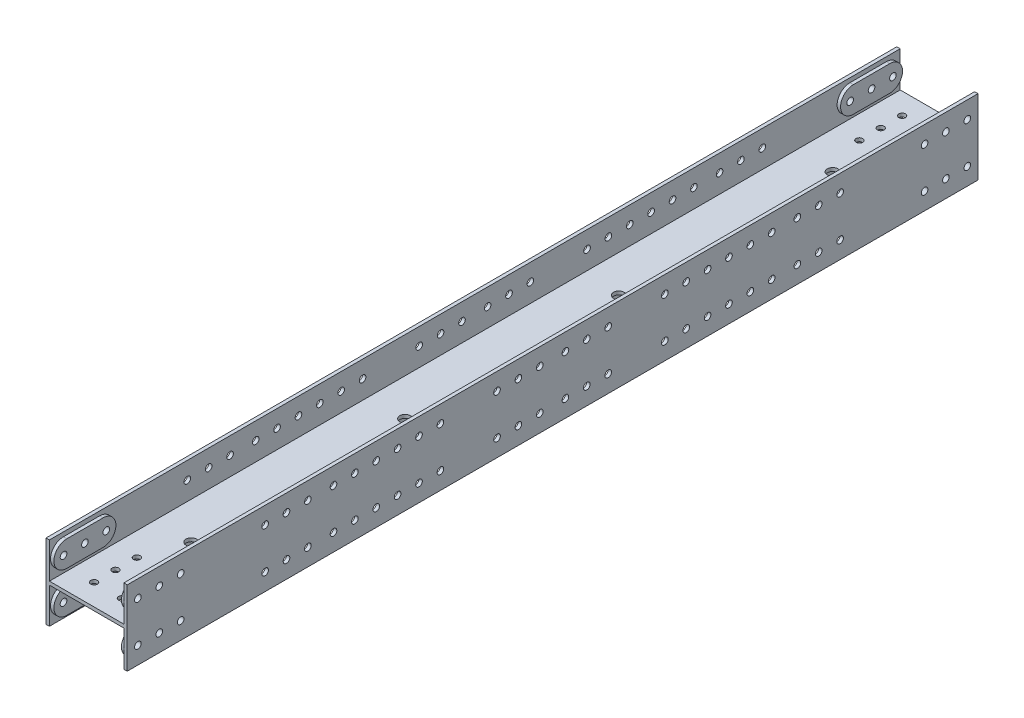
from build123d import *

# Parameters (mm, degrees)
EXTRUDE_1_DEPTH          = 1990
CUT_EXTRUDE_2_DEPTH      = 2007.695044096
CUT_EXTRUDE_2_DEPTH_BACK = 2007.695044096
SKETCH_6_R               = 15.5
SKETCH_6_R_2             = 25
EXTRUDE_4_DEPTH          = 16
CUT_EXTRUDE_6_DEPTH      = 2007.695044096
CUT_EXTRUDE_6_DEPTH_BACK = 2007.695044096
SKETCH_4_R               = 15.5


with BuildPart() as part:
    # 草图3 → 拉伸1 (new, symmetric)
    with BuildSketch(Plane.XY):
        Polygon((174, -8), (-174, -8), (-174, -175), (-190, -175), (-190, 175), (-174, 175), (-174, 8), (174, 8), (174, 175), (190, 175), (190, -175), (174, -175), align=None)
    extrude(amount=EXTRUDE_1_DEPTH, both=True)

    # 草图6 → 拉伸2 (cut, two sides: drawn at the far end of the back side and taken through both)
    with BuildSketch(Plane(origin=(0, 0, 0), x_dir=(1, 0, 0), z_dir=(0, 1, 0)).offset(-CUT_EXTRUDE_2_DEPTH_BACK)):
        with Locations(Location((-65, -1890, 0), (0, 0, 270))):
            Circle(SKETCH_6_R)
        with Locations(Location((-65, -1790, 0), (0, 0, 270))):
            Circle(SKETCH_6_R)
        with Locations(Location((-65, -1690, 0), (0, 0, 270))):
            Circle(SKETCH_6_R)
        with Locations(Location((65, -1890, 0), (0, 0, 270))):
            Circle(SKETCH_6_R)
        with Locations(Location((65, -1790, 0), (0, 0, 270))):
            Circle(SKETCH_6_R)
        with Locations(Location((65, -1690, 0), (0, 0, 270))):
            Circle(SKETCH_6_R)
        with Locations(Location((0, -1500, 0), (0, 0, 270))):
            Circle(SKETCH_6_R_2)
        with Locations(Location((0, -500, 0), (0, 0, 270))):
            Circle(SKETCH_6_R_2)
        with Locations(Location((0, 500, 0), (0, 0, 270))):
            Circle(SKETCH_6_R_2)
        with Locations(Location((0, 1500, 0), (0, 0, 270))):
            Circle(SKETCH_6_R_2)
        with Locations(Location((65, 1690, 0), (0, 0, 270))):
            Circle(SKETCH_6_R)
        with Locations(Location((65, 1790, 0), (0, 0, 270))):
            Circle(SKETCH_6_R)
        with Locations(Location((65, 1890, 0), (0, 0, 270))):
            Circle(SKETCH_6_R)
        with Locations(Location((-65, 1690, 0), (0, 0, 270))):
            Circle(SKETCH_6_R)
        with Locations(Location((-65, 1790, 0), (0, 0, 270))):
            Circle(SKETCH_6_R)
        with Locations(Location((-65, 1890, 0), (0, 0, 270))):
            Circle(SKETCH_6_R)
    extrude(amount=CUT_EXTRUDE_2_DEPTH + CUT_EXTRUDE_2_DEPTH_BACK, mode=Mode.SUBTRACT)

    # 草图9 → 拉伸4 (add)
    with BuildSketch(Plane.ZY.offset(-174)):
        with BuildLine():
            Line((-1755, -155), (-1925, -155))
            ThreePointArc((-1925, -155), (-1985, -95), (-1925, -35))
            Line((-1925, -35), (-1755, -35))
            ThreePointArc((-1755, -35), (-1695, -95), (-1755, -155))
        make_face()
        with BuildLine():
            Line((1755, -155), (1925, -155))
            ThreePointArc((1925, -155), (1985, -95), (1925, -35))
            Line((1925, -35), (1755, -35))
            ThreePointArc((1755, -35), (1695, -95), (1755, -155))
        make_face()
        with BuildLine():
            Line((1755, 155), (1925, 155))
            ThreePointArc((1925, 155), (1985, 95), (1925, 35))
            Line((1925, 35), (1755, 35))
            ThreePointArc((1755, 35), (1695, 95), (1755, 155))
        make_face()
        with BuildLine():
            Line((-1755, 155), (-1925, 155))
            ThreePointArc((-1925, 155), (-1985, 95), (-1925, 35))
            Line((-1925, 35), (-1755, 35))
            ThreePointArc((-1755, 35), (-1695, 95), (-1755, 155))
        make_face()
    extrude_4 = extrude(amount=EXTRUDE_4_DEPTH)

    # 镜向1: 拉伸4 across plane
    add(extrude_4.mirror(Plane(origin=(0, 0, 0), x_dir=(0, 0, 1), z_dir=(1, 0, 0))))

    # 草图4 → 拉伸6 (cut, two sides: drawn at the far end of the back side and taken through both)
    with BuildSketch(Plane(origin=(0, 0, 0), x_dir=(0, 0, -1), z_dir=(1, 0, 0)).offset(-CUT_EXTRUDE_6_DEPTH_BACK)):
        with Locations((-1940, 95)):
            Circle(SKETCH_4_R)
        with Locations((-1840, 95)):
            Circle(SKETCH_4_R)
        with Locations((-1740, 95)):
            Circle(SKETCH_4_R)
        with Locations((-1345, 95)):
            Circle(SKETCH_4_R)
        with Locations((-1245, 95)):
            Circle(SKETCH_4_R)
        with Locations((-1145, 95)):
            Circle(SKETCH_4_R)
        with Locations((-260, 95)):
            Circle(SKETCH_4_R)
        with Locations((-160, 95)):
            Circle(SKETCH_4_R)
        with Locations((-60, 95)):
            Circle(SKETCH_4_R)
        with Locations((-525, -95)):
            Circle(SKETCH_4_R)
        with Locations((-625, -95)):
            Circle(SKETCH_4_R)
        with Locations((-725, -95)):
            Circle(SKETCH_4_R)
        with Locations((-825, -95)):
            Circle(SKETCH_4_R)
        with Locations((-925, -95)):
            Circle(SKETCH_4_R)
        with Locations((-1025, -95)):
            Circle(SKETCH_4_R)
        with Locations((-60, -95)):
            Circle(SKETCH_4_R)
        with Locations((-160, -95)):
            Circle(SKETCH_4_R)
        with Locations((-260, -95)):
            Circle(SKETCH_4_R)
        with Locations((-1145, -95)):
            Circle(SKETCH_4_R)
        with Locations((-1245, -95)):
            Circle(SKETCH_4_R)
        with Locations((-1345, -95)):
            Circle(SKETCH_4_R)
        with Locations(Location((-1740, -95, 0), (0, 0, 180))):
            Circle(SKETCH_4_R)
        with Locations(Location((-1840, -95, 0), (0, 0, 180))):
            Circle(SKETCH_4_R)
        with Locations(Location((-1940, -95, 0), (0, 0, 180))):
            Circle(SKETCH_4_R)
        with Locations((-1025, 95)):
            Circle(SKETCH_4_R)
        with Locations((-925, 95)):
            Circle(SKETCH_4_R)
        with Locations((-825, 95)):
            Circle(SKETCH_4_R)
        with Locations((-725, 95)):
            Circle(SKETCH_4_R)
        with Locations((-625, 95)):
            Circle(SKETCH_4_R)
        with Locations((-525, 95)):
            Circle(SKETCH_4_R)
        with Locations((525, 95)):
            Circle(SKETCH_4_R)
        with Locations((625, 95)):
            Circle(SKETCH_4_R)
        with Locations((725, 95)):
            Circle(SKETCH_4_R)
        with Locations((825, 95)):
            Circle(SKETCH_4_R)
        with Locations((925, 95)):
            Circle(SKETCH_4_R)
        with Locations((1025, 95)):
            Circle(SKETCH_4_R)
        with Locations((1940, -95)):
            Circle(SKETCH_4_R)
        with Locations((1840, -95)):
            Circle(SKETCH_4_R)
        with Locations((1740, -95)):
            Circle(SKETCH_4_R)
        with Locations((1345, -95)):
            Circle(SKETCH_4_R)
        with Locations((1245, -95)):
            Circle(SKETCH_4_R)
        with Locations((1145, -95)):
            Circle(SKETCH_4_R)
        with Locations((260, -95)):
            Circle(SKETCH_4_R)
        with Locations((160, -95)):
            Circle(SKETCH_4_R)
        with Locations((60, -95)):
            Circle(SKETCH_4_R)
        with Locations((1025, -95)):
            Circle(SKETCH_4_R)
        with Locations((925, -95)):
            Circle(SKETCH_4_R)
        with Locations((825, -95)):
            Circle(SKETCH_4_R)
        with Locations((725, -95)):
            Circle(SKETCH_4_R)
        with Locations((625, -95)):
            Circle(SKETCH_4_R)
        with Locations((525, -95)):
            Circle(SKETCH_4_R)
        with Locations((60, 95)):
            Circle(SKETCH_4_R)
        with Locations((160, 95)):
            Circle(SKETCH_4_R)
        with Locations((260, 95)):
            Circle(SKETCH_4_R)
        with Locations((1145, 95)):
            Circle(SKETCH_4_R)
        with Locations((1245, 95)):
            Circle(SKETCH_4_R)
        with Locations((1345, 95)):
            Circle(SKETCH_4_R)
        with Locations(Location((1740, 95, 0), (0, 0, 180))):
            Circle(SKETCH_4_R)
        with Locations(Location((1840, 95, 0), (0, 0, 180))):
            Circle(SKETCH_4_R)
        with Locations(Location((1940, 95, 0), (0, 0, 180))):
            Circle(SKETCH_4_R)
    extrude(amount=CUT_EXTRUDE_6_DEPTH + CUT_EXTRUDE_6_DEPTH_BACK, mode=Mode.SUBTRACT)


solid = part.part
